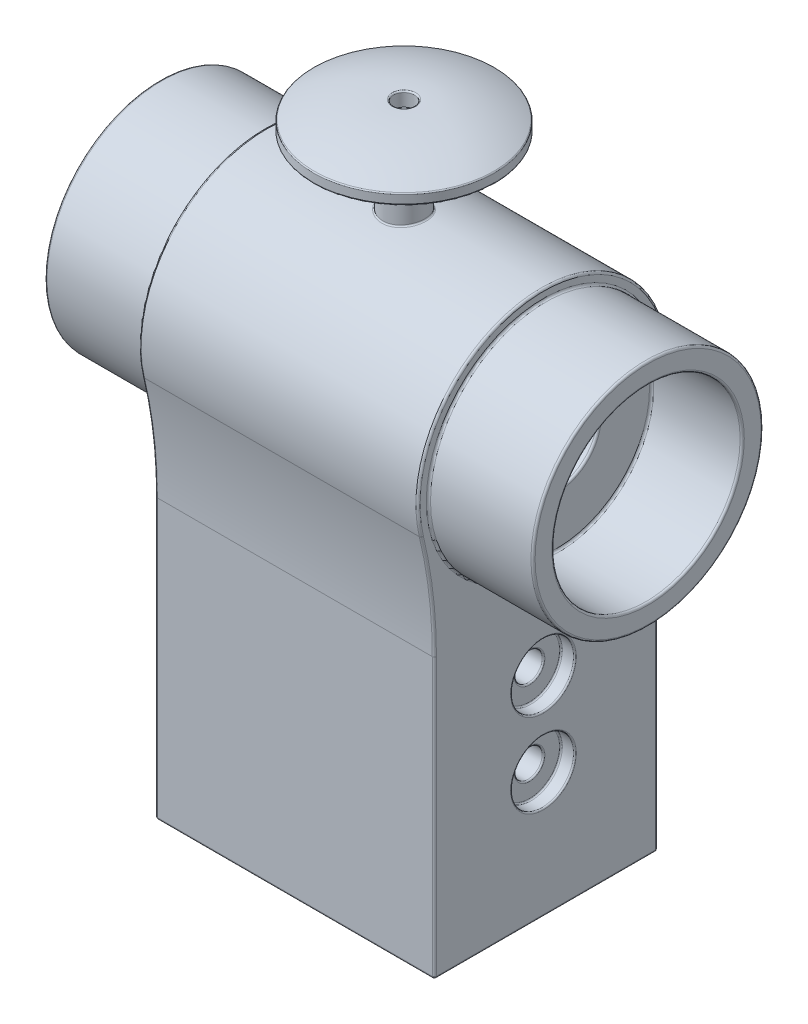
from build123d import *

# Parameters (mm, degrees)
BOSS_EXTRUDE1_DEPTH      = 10
BOSS_EXTRUDE1_DEPTH_BACK = 10
BOSS_EXTRUDE2_DEPTH      = 17.5
BOSS_EXTRUDE2_DEPTH_BACK = 17.5
SKETCH2_R                = 8.25
SKETCH3_R                = 6.75
CUT_EXTRUDE1_DEPTH       = 47.968074263
BOSS_EXTRUDE3_DEPTH      = 11
BOSS_EXTRUDE3_DEPTH_BACK = 11
SKETCH4_R                = 6.75
SKETCH4_R_2              = 3
CUT_EXTRUDE2_DEPTH       = 36.878266402
CUT_EXTRUDE2_DEPTH_BACK  = 36.878266402
SKETCH5_R                = 1
SKETCH6_R                = 2.25
CUT_EXTRUDE3_DEPTH       = 1
CUT_EXTRUDE4_START       = -1
SKETCH7_R                = 2.25
CUT_EXTRUDE4_DEPTH       = 1
SKETCH8_R                = 5
CUT_EXTRUDE5_DEPTH       = 21
FILLET1_R                = 0.15
FILLET2_R                = 0.1
FILLET3_R                = 0.15


with BuildPart() as part:
    # Sketch1 → Boss-Extrude1 (new, two sides: drawn at the far end of the back side and taken through both)
    with BuildSketch(Plane(origin=(0, 0, 0), x_dir=(0, 0, -1), z_dir=(1, 0, 0)).offset(-BOSS_EXTRUDE1_DEPTH_BACK)):
        with BuildLine():
            Line((8.175938629, -10), (8.175938629, -30))
            Line((8.175938629, -30), (-7.824061371, -30))
            Line((-7.824061371, -30), (-7.824061371, -10))
            ThreePointArc((-7.824061371, -10), (-8.057465992, -6.016650135), (-8.754485355, -2.087818517))
            ThreePointArc((-8.754485355, -2.087818517), (-0.313459826, 8.994539618), (8.878590578, -1.473305586))
            ThreePointArc((8.878590578, -1.473305586), (8.35189883, -5.722201577), (8.175938629, -10))
        make_face()
    extrude(amount=BOSS_EXTRUDE1_DEPTH + BOSS_EXTRUDE1_DEPTH_BACK)

    # Sketch2 → Boss-Extrude2 (add, two sides: drawn at the far end of the back side and taken through both)
    with BuildSketch(Plane(origin=(0, 0, 0), x_dir=(0, 0, -1), z_dir=(1, 0, 0)).offset(-BOSS_EXTRUDE2_DEPTH_BACK)):
        Circle(SKETCH2_R)
    extrude(amount=BOSS_EXTRUDE2_DEPTH + BOSS_EXTRUDE2_DEPTH_BACK)

    # Sketch3 → Cut-Extrude1 (cut, through all)
    with BuildSketch(Plane(origin=(17.5, 0, 0), x_dir=(0, 0, -1), z_dir=(1, 0, 0))):
        Circle(SKETCH3_R)
    extrude(amount=-CUT_EXTRUDE1_DEPTH, mode=Mode.SUBTRACT)

    # Sketch4 → Boss-Extrude3 (add, two sides: drawn at the far end of the back side and taken through both)
    with BuildSketch(Plane(origin=(0, 0, 0), x_dir=(0, 0, -1), z_dir=(1, 0, 0)).offset(-BOSS_EXTRUDE3_DEPTH_BACK)):
        Circle(SKETCH4_R)
        Circle(SKETCH4_R_2, mode=Mode.SUBTRACT)
    extrude(amount=BOSS_EXTRUDE3_DEPTH + BOSS_EXTRUDE3_DEPTH_BACK)

    # Sketch5 → Cut-Extrude2 (cut, two sides: drawn at the far end of the back side and taken through both)
    with BuildSketch(Plane(origin=(0, 0, 0), x_dir=(0, 0, -1), z_dir=(1, 0, 0)).offset(-CUT_EXTRUDE2_DEPTH_BACK)):
        with Locations(Location((0, -15, 0), (0, 0, 180))):
            Circle(SKETCH5_R)
        with Locations(Location((0, -21, 0), (0, 0, 180))):
            Circle(SKETCH5_R)
    extrude(amount=CUT_EXTRUDE2_DEPTH + CUT_EXTRUDE2_DEPTH_BACK, mode=Mode.SUBTRACT)

    # Sketch6 → Cut-Extrude3 (cut)
    with BuildSketch(Plane(origin=(10, 0, 0), x_dir=(0, 0, -1), z_dir=(1, 0, 0))):
        with Locations((0, -15)):
            Circle(SKETCH6_R)
        with Locations((0, -21)):
            Circle(SKETCH6_R)
    extrude(amount=-CUT_EXTRUDE3_DEPTH, mode=Mode.SUBTRACT)

    # Sketch7 → Cut-Extrude4 (cut)
    with BuildSketch(Plane.ZY.offset(10).offset(CUT_EXTRUDE4_START)):
        with Locations(Location((0, -21, 0), (0, 0, 180))):
            Circle(SKETCH7_R)
        with Locations(Location((0, -15, 0), (0, 0, 180))):
            Circle(SKETCH7_R)
    extrude(amount=CUT_EXTRUDE4_DEPTH, mode=Mode.SUBTRACT)

    # Sketch8 → Cut-Extrude5 (cut)
    with BuildSketch(Plane.XZ.offset(30)):
        with Locations(Location((0, 0, 0), (0, 0, 270))):
            Circle(SKETCH8_R)
    extrude(amount=-CUT_EXTRUDE5_DEPTH, mode=Mode.SUBTRACT)

    # Sketch9 → Revolve1 (revolve)
    with BuildSketch(Plane.XY, mode=Mode.PRIVATE) as revolve1_sk:
        with BuildLine():
            Line((0, 8.25), (0, 14.75))
            Line((0, 14.75), (-0.75, 14.75))
            Line((-0.75, 14.75), (-0.75, 15.75))
            ThreePointArc((-0.75, 15.75), (-3.702805909, 15.482907183), (-6.5, 14.5))
            Line((-6.5, 14.5), (-6.5, 13.75))
            Line((-6.5, 13.75), (-1.5, 13.75))
            Line((-1.5, 13.75), (-1.5, 8.25))
            Line((-1.5, 8.25), (0, 8.25))
        make_face()
    revolve(revolve1_sk.sketch.rotate(Axis((0, 8.25, 0), (0, 1, 0)), 270), axis=Axis((0, 8.25, 0), (0, 1, 0)))

    # Fillet1
    fillet1_edges = [part.edges().sort_by_distance(p)[0] for p in [
        (-10, 0, 8.25),
        (10, 0, 8.25),
        (-17.5, 0, 8.25),
        (17.5, 0, 8.25),
        (-17.5, 0, 6.75),
        (17.5, 0, 6.75),
        (-11, 0, 6.75),
        (-11, 0, 3),
        (11, 0, 3),
        (11, 0, 6.75),
    ]]
    fillet(fillet1_edges, radius=FILLET1_R)

    # Fillet2
    fillet2_edges = [part.edges().sort_by_distance(p)[0] for p in [
        (-3e-09, 8.87411967, 1.500000042),
        (0, 13.75, 1.5),
        (0, 13.75, 6.5),
        (0, 14.5, 6.5),
        (0, 15.75, 0.75),
        (10, -15, 2.25),
        (9, -15, 2.25),
        (9, -15, -1),
        (10, -21, 2.25),
        (9, -21, 2.25),
        (9, -21, -1),
        (-10, -21, 2.25),
        (-9, -21, 2.25),
        (-9, -21, -1),
        (-10, -15, 2.25),
        (-9, -15, 2.25),
        (-9, -15, -1),
        (-4.898979487, -20.999999999, -1.000000001),
    ]]
    fillet(fillet2_edges, radius=FILLET2_R)

    # Fillet3
    fillet3_edges = [part.edges().sort_by_distance(p)[0] for p in [
        (0, -30, -8.175938629),
        (0, -30, 7.824061371),
        (-10, -6.016650135, 8.057465992),
        (-10, -20, 7.824061371),
        (10, -5.722201577, -8.35189883),
        (10, 8.994539618, 0.313459826),
        (10, -6.016650135, 8.057465992),
        (10, -20, 7.824061371),
        (10, -30, -0.175938629),
        (10, -20, -8.175938629),
        (-10, -30, -0.175938629),
        (-10, -20, -8.175938629),
        (-10, -5.722201577, -8.35189883),
        (-10, 8.994539618, 0.313459826),
        (0, -30, 5),
    ]]
    fillet(fillet3_edges, radius=FILLET3_R)


solid = part.part
